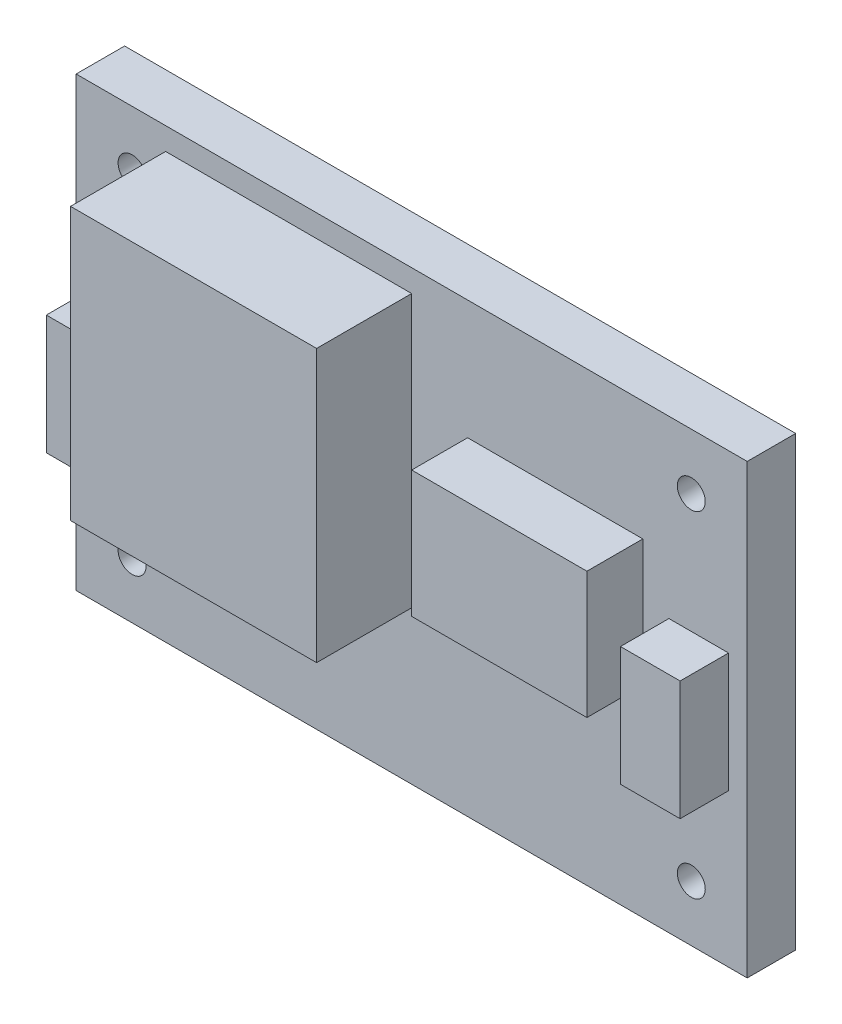
from build123d import *

# Parameters (mm, degrees)
SKIZZE1_W                       = 18
SKIZZE1_H                       = 12
PLATINE_DEPTH                   = 1.3
SKIZZE2_W                       = 6.6
SKIZZE2_H                       = 7.3
AUFSATZ_LINEAR_AUSTRAGEN2_DEPTH = 2.55
SKIZZE3_W                       = 4.7
SKIZZE3_H                       = 3.4
AUFSATZ_LINEAR_AUSTRAGEN3_DEPTH = 1.5
SKIZZE4_R                       = 0.375
SCHNITT_LINEAR_AUSTRAGEN1_DEPTH = 22.783078295
SKIZZE5_W                       = 1.6
SKIZZE5_H                       = 3.2
AUFSATZ_LINEAR_AUSTRAGEN4_DEPTH = 1.3


with BuildPart() as part:
    # Skizze1 → Platine (new body)
    with BuildSketch(Plane.XY):
        with Locations((9, 6)):
            Rectangle(SKIZZE1_W, SKIZZE1_H)
    extrude(amount=PLATINE_DEPTH)

    # Skizze2 → Aufsatz-Linear austragen2 (add)
    with BuildSketch(Plane.XY.offset(1.3)):
        with Locations((5.7, 7.75)):
            Rectangle(SKIZZE2_W, SKIZZE2_H)
    extrude(amount=AUFSATZ_LINEAR_AUSTRAGEN2_DEPTH)

    # Skizze3 → Aufsatz-Linear austragen3 (add)
    with BuildSketch(Plane.XY.offset(1.3)):
        with Locations((12.85, 7.1)):
            Rectangle(SKIZZE3_W, SKIZZE3_H)
    extrude(amount=AUFSATZ_LINEAR_AUSTRAGEN3_DEPTH)

    # Skizze4 → Schnitt-Linear austragen1 (cut, through all)
    with BuildSketch(Plane.XY.offset(1.3)):
        with Locations((1.5, 10.5)):
            Circle(SKIZZE4_R)
        with Locations(Location((16.5, 10.5, 0), (0, 0, 180))):
            Circle(SKIZZE4_R)
        with Locations((16.5, 1.5)):
            Circle(SKIZZE4_R)
        with Locations(Location((1.5, 1.5, 0), (0, 0, 180))):
            Circle(SKIZZE4_R)
    extrude(amount=-SCHNITT_LINEAR_AUSTRAGEN1_DEPTH, mode=Mode.SUBTRACT)

    # Skizze5 → Aufsatz-Linear austragen4 (add)
    with BuildSketch(Plane.XY.offset(1.3)):
        with Locations((1.3, 5.7)):
            Rectangle(SKIZZE5_W, SKIZZE5_H)
        with Locations((16.7, 5.7)):
            Rectangle(SKIZZE5_W, SKIZZE5_H)
    extrude(amount=AUFSATZ_LINEAR_AUSTRAGEN4_DEPTH)


solid = part.part
